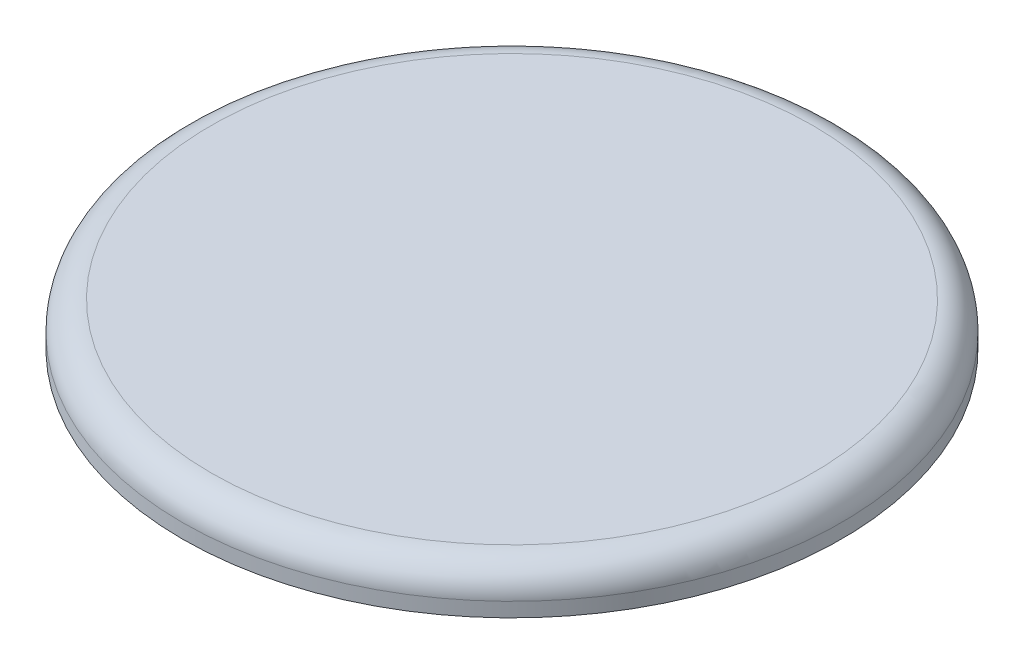
from build123d import *


with BuildPart() as part:
    # Esquisse2 → Révolution1 (revolve)
    with BuildSketch(Plane.XY, mode=Mode.PRIVATE) as r_volution1_sk:
        with BuildLine():
            Line((0, 5.5), (21, 5.5))
            ThreePointArc((21, 5.5), (22.414213562, 4.914213562), (23, 3.5))
            Line((23, 3.5), (23, 2.5))
            Line((23, 2.5), (19, 2.5))
            Line((19, 2.5), (19, 0))
            Line((19, 0), (17, 0))
            Line((17, 0), (17, 2.5))
            Line((17, 2.5), (0, 2.5))
            Line((0, 2.5), (0, 5.5))
        make_face()
    revolve(r_volution1_sk.sketch.rotate(Axis((0, 31.915652174, 0), (0, -1, 0)), 90), axis=Axis((0, 31.915652174, 0), (0, -1, 0)))


solid = part.part
